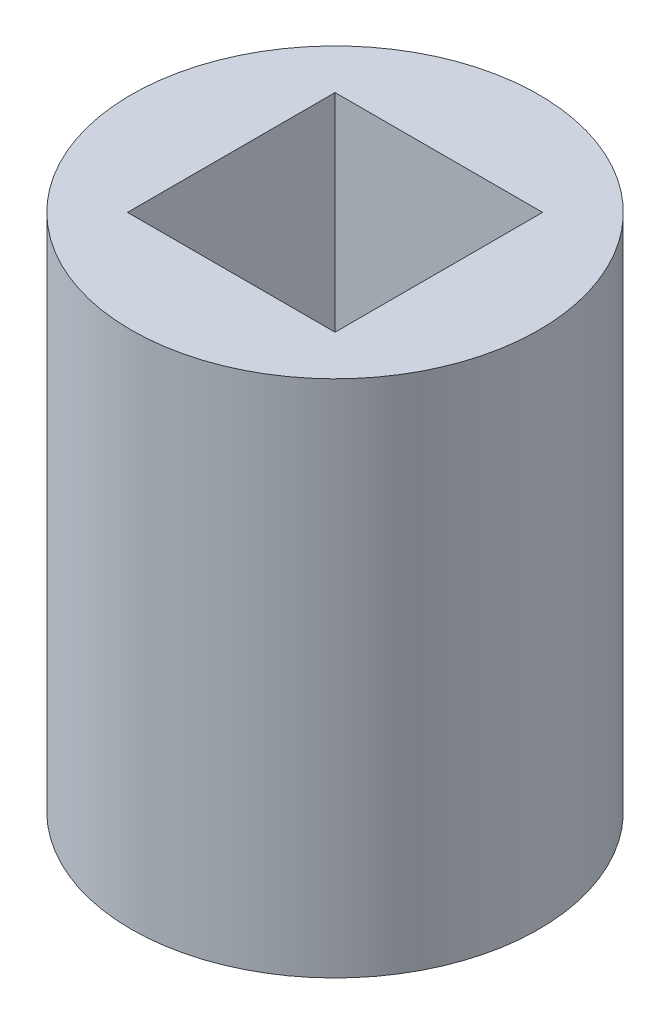
from build123d import *

# Parameters (mm, degrees)
SKETCH1_R           = 5.5
BOSS_EXTRUDE1_DEPTH = 14
SKETCH2_W           = 5.6
SKETCH2_H           = 5.6
CUT_EXTRUDE1_DEPTH  = 8


with BuildPart() as part:
    # Sketch1 → Boss-Extrude1 (new body)
    with BuildSketch(Plane(origin=(0, 0, 0), x_dir=(1, 0, 0), z_dir=(0, 1, 0))):
        with Locations(Location((0, 0, 0), (0, 0, 270))):
            Circle(SKETCH1_R)
    extrude(amount=BOSS_EXTRUDE1_DEPTH)

    # Sketch2 → Cut-Extrude1 (cut)
    with BuildSketch(Plane(origin=(0, 14, 0), x_dir=(1, 0, 0), z_dir=(0, 1, 0))):
        Rectangle(SKETCH2_W, SKETCH2_H)
    extrude(amount=-CUT_EXTRUDE1_DEPTH, mode=Mode.SUBTRACT)


solid = part.part
